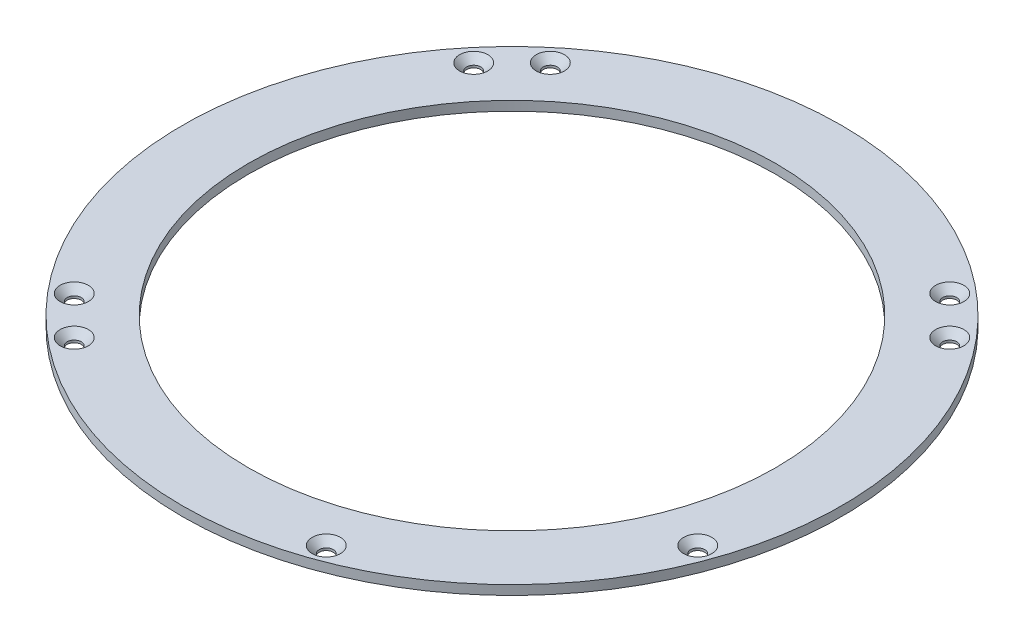
from build123d import *

# Parameters (mm, degrees)
SKETCH_1_R          = 70
SKETCH_1_R_2        = 56
EXTRUDE_1_DEPTH     = 2
SKETCH_2_R          = 1.5
CUT_EXTRUDE_1_DEPTH = 3
CHAMFER_1_SIZE      = 1.5


with BuildPart() as part:
    # 草图1 → 凸台-拉伸1 (new body)
    with BuildSketch(Plane(origin=(0, 0, 0), x_dir=(1, 0, 0), z_dir=(0, 1, 0))):
        with Locations(Location((0, 0, 0), (0, 0, 270))):
            Circle(SKETCH_1_R)
        with Locations(Location((0, 0, 0), (0, 0, 270))):
            Circle(SKETCH_1_R_2, mode=Mode.SUBTRACT)
    extrude(amount=EXTRUDE_1_DEPTH)

    # 草图2 → 切除-拉伸1 (cut)
    with BuildSketch(Plane(origin=(0, 2, 0), x_dir=(1, 0, 0), z_dir=(0, 1, 0))):
        with Locations(Location((42.423982239, 50.558933246, 0), (0, 0, 270))):
            Circle(SKETCH_2_R)
        with Locations(Location((50.558933246, 42.423982239, 0), (0, 0, 270))):
            Circle(SKETCH_2_R)
        with Locations(Location((-50.558933246, 42.423982239, 0), (0, 0, 270))):
            Circle(SKETCH_2_R)
        with Locations(Location((-42.423982239, 50.558933246, 0), (0, 0, 270))):
            Circle(SKETCH_2_R)
        with Locations(Location((-50.558933246, -42.423982239, 0), (0, 0, 270))):
            Circle(SKETCH_2_R)
        with Locations(Location((-42.423982239, -50.558933246, 0), (0, 0, 270))):
            Circle(SKETCH_2_R)
        with Locations(Location((22.573329459, -62.019712972, 0), (0, 0, 270))):
            Circle(SKETCH_2_R)
        with Locations(Location((62.019712972, -22.573329459, 0), (0, 0, 270))):
            Circle(SKETCH_2_R)
    extrude(amount=-CUT_EXTRUDE_1_DEPTH, mode=Mode.SUBTRACT)

    # 倒角1
    chamfer_1_edges = [part.edges().sort_by_distance(p)[0] for p in [
        (50.558933246, 2, -43.923982239),
        (22.573329459, 2, 60.519712972),
        (-50.558933246, 2, -43.923982239),
        (-42.423982239, 2, -52.058933246),
        (-50.558933246, 2, 40.923982239),
        (-42.423982239, 2, 49.058933246),
        (62.019712972, 2, 21.073329459),
        (42.423982239, 2, -52.058933246),
    ]]
    chamfer(chamfer_1_edges, length=CHAMFER_1_SIZE)


solid = part.part
